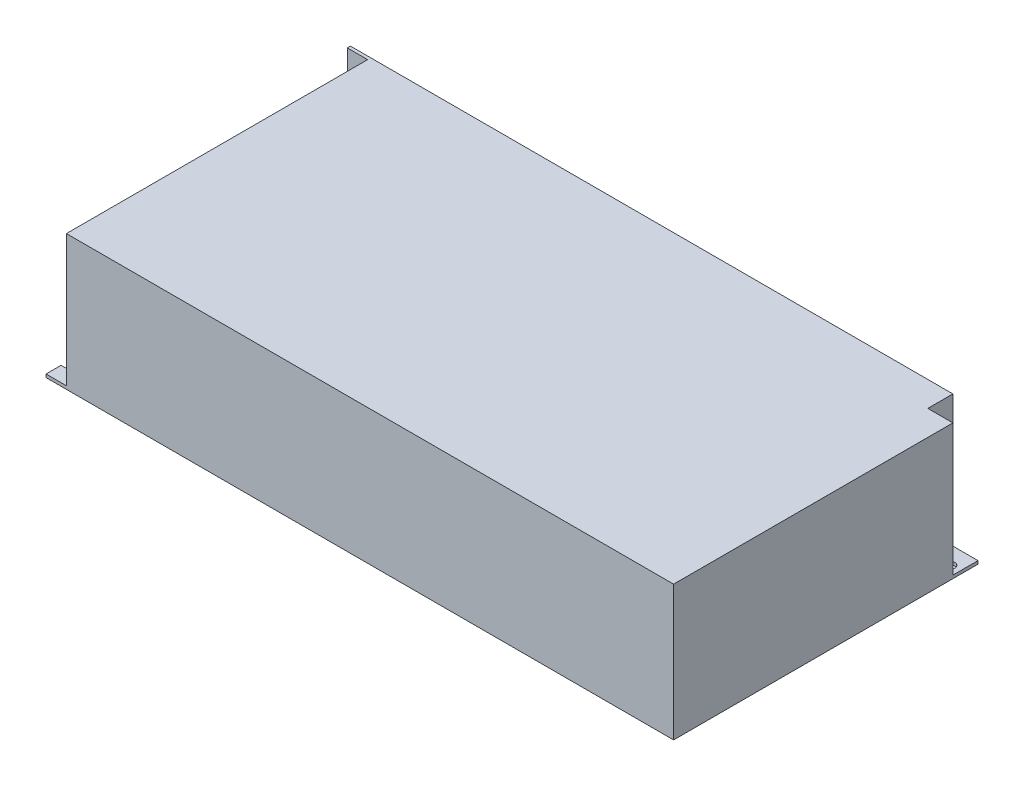
from build123d import *

# Parameters (mm, degrees)
SKETCH1_W           = 200
SKETCH1_H           = 97
BOSS_EXTRUDE1_DEPTH = 43
CUT_EXTRUDE1_DEPTH  = 96
SKETCH3_W           = 6.5
SKETCH3_H           = 13
SKETCH3_W_2         = 8
SKETCH3_H_2         = 8
CUT_EXTRUDE2_DEPTH  = 42
SKETCH4_R           = 1.6
CUT_EXTRUDE3_DEPTH  = 119.811826011


with BuildPart() as part:
    # Sketch1 → Boss-Extrude1 (new body)
    with BuildSketch(Plane(origin=(0, 0, 0), x_dir=(1, 0, 0), z_dir=(0, 1, 0))):
        Rectangle(SKETCH1_W, SKETCH1_H)
    extrude(amount=BOSS_EXTRUDE1_DEPTH)

    # Sketch2 → Cut-Extrude1 (cut)
    with BuildSketch(Plane.XY.offset(48.5)):
        with BuildLine():
            Line((-93.5, 43), (-93.5, 17.5))
            ThreePointArc((-93.5, 17.5), (-94.365227926, 12.762263764), (-96.84920953, 8.636176103))
            ThreePointArc((-96.84920953, 8.636176103), (-98.879103447, 5.571249802), (-100, 2.070130916))
            Line((-100, 2.070130916), (-100, 43))
            Line((-100, 43), (-93.5, 43))
        make_face()
    extrude(amount=-CUT_EXTRUDE1_DEPTH, mode=Mode.SUBTRACT)

    # Sketch3 → Cut-Extrude2 (cut)
    with BuildSketch(Plane(origin=(0, 43, 0), x_dir=(1, 0, 0), z_dir=(0, 1, 0))):
        with Locations((-96.75, -42)):
            Rectangle(SKETCH3_W, SKETCH3_H)
        with Locations((96, 44.5)):
            Rectangle(SKETCH3_W_2, SKETCH3_H_2)
    extrude(amount=-CUT_EXTRUDE2_DEPTH, mode=Mode.SUBTRACT)

    # Sketch4 → Cut-Extrude3 (cut, through all)
    with BuildSketch(Plane(origin=(0, 1, 0), x_dir=(1, 0, 0), z_dir=(0, 1, 0))):
        with Locations(Location((96.8, 42.7, 0), (0, 0, 270))):
            Circle(SKETCH4_R)
        with BuildLine():
            Line((-97.001938149, -43.7), (-106.165293612, -43.7))
            ThreePointArc((-106.165293612, -43.7), (-108.065293612, -41.8), (-106.165293612, -39.9))
            Line((-106.165293612, -39.9), (-97.001938149, -39.9))
            ThreePointArc((-97.001938149, -39.9), (-95.101938149, -41.8), (-97.001938149, -43.7))
        make_face()
    extrude(amount=-CUT_EXTRUDE3_DEPTH, mode=Mode.SUBTRACT)


solid = part.part
